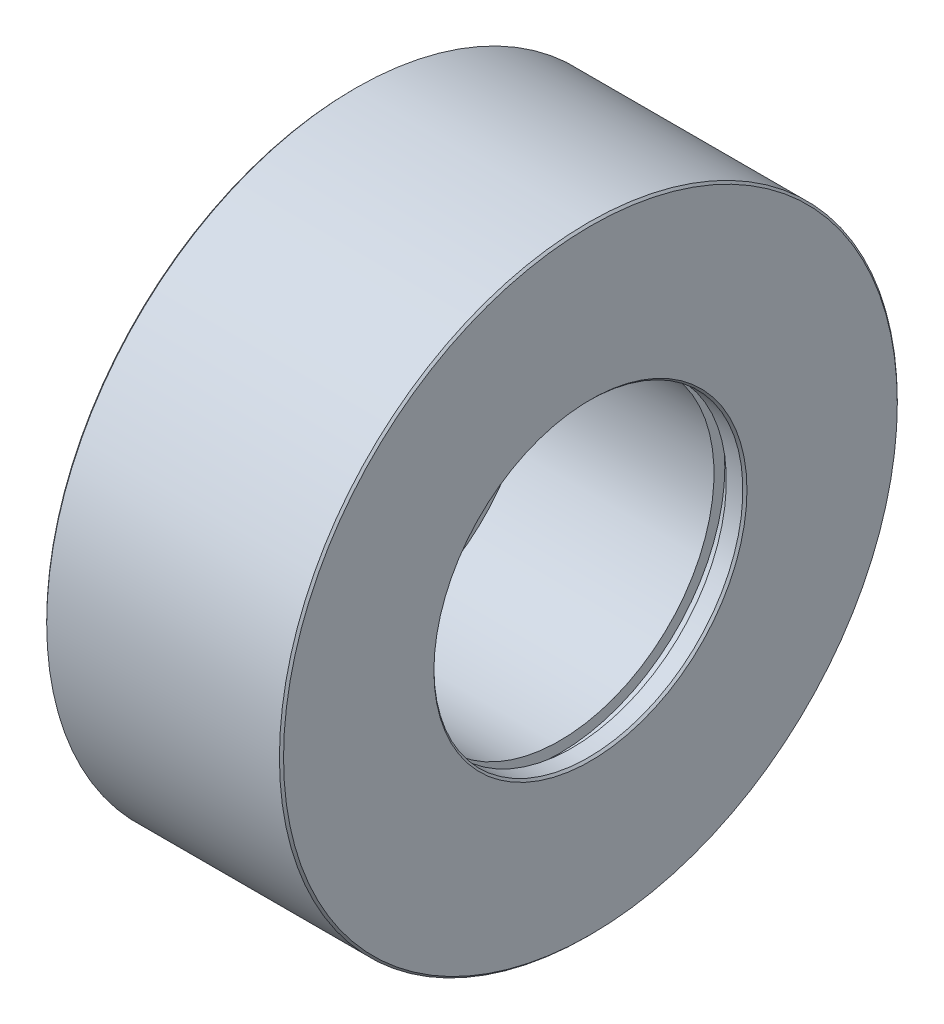
from build123d import *

# Parameters (mm, degrees)
CHAMFER1_SIZE = 0.2


with BuildPart() as part:
    # Sketch1 → Revolve1 (revolve)
    with BuildSketch(Plane.XY, mode=Mode.PRIVATE) as revolve1_sk:
        Polygon((0, 13.5), (2, 13.5), (2, 15), (20, 15), (20, 16.05), (21.2, 16.05), (21.2, 15), (23, 15), (23, 30), (0, 30), align=None)
    revolve(revolve1_sk.sketch.rotate(Axis((0, 0, 0), (1, 0, 0)), 90), axis=Axis((0, 0, 0), (1, 0, 0)))

    # Chamfer1
    chamfer1_edges = [part.edges().sort_by_distance(p)[0] for p in [
        (2, 0, -13.5),
        (0, 0, -13.5),
        (0, 0, -30),
        (23, 0, -30),
        (23, 0, -15),
    ]]
    chamfer(chamfer1_edges, length=CHAMFER1_SIZE)


solid = part.part
